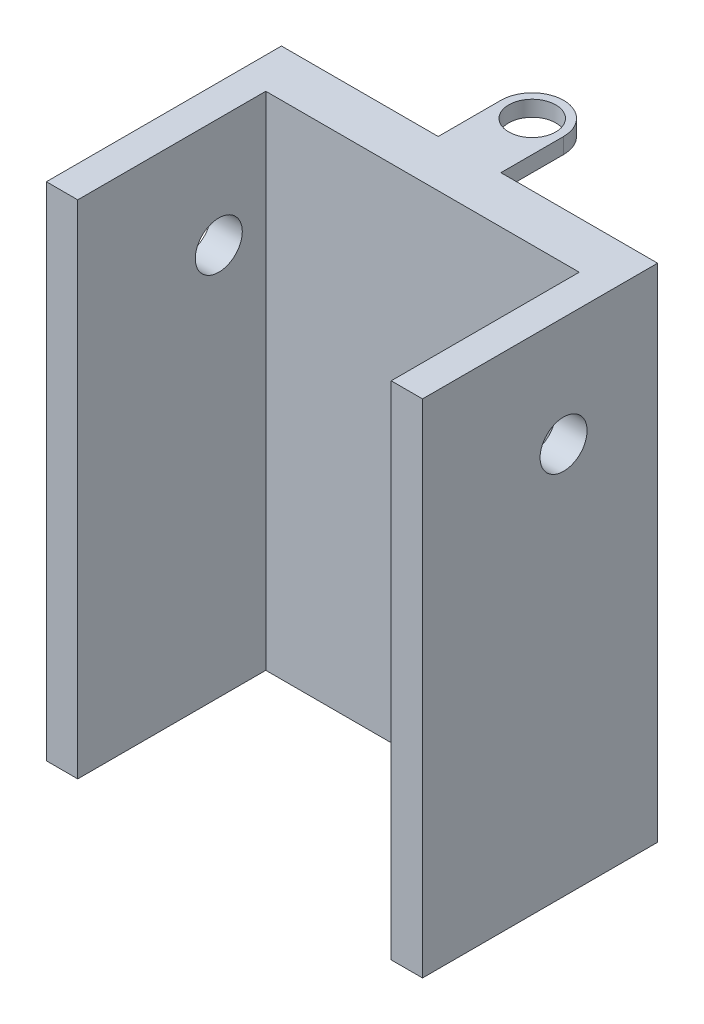
from build123d import *

# Parameters (mm, degrees)
ESQUISSE1_W                  = 20
ESQUISSE1_H                  = 32
BOSS_EXTRU_1_DEPTH           = 3
ESQUISSE2_W                  = 2
ESQUISSE2_H                  = 32
BOSS_EXTRU_2_DEPTH           = 15
ENL_V_MAT_EXTRU_1_DEPTH      = 26
ENL_V_MAT_EXTRU_1_DEPTH_BACK = 26
ESQUISSE3_R                  = 1.5
ESQUISSE4_W                  = 0.474893163
ESQUISSE4_H                  = 2.645833334
ENL_V_MAT_EXTRU_2_DEPTH      = 1
ESQUISSE5_R                  = 1.5
BOSS_EXTRU_3_DEPTH           = 1


with BuildPart() as part:
    # Esquisse1 → Boss.-Extru.1 (new body)
    with BuildSketch(Plane.XY):
        Rectangle(ESQUISSE1_W, ESQUISSE1_H)
    extrude(amount=BOSS_EXTRU_1_DEPTH)

    # Esquisse2 → Boss.-Extru.2 (add)
    with BuildSketch(Plane.XY):
        with Locations((11, 0)):
            Rectangle(ESQUISSE2_W, ESQUISSE2_H)
        with Locations((-11, 0)):
            Rectangle(ESQUISSE2_W, ESQUISSE2_H)
    extrude(amount=BOSS_EXTRU_2_DEPTH)

    # Esquisse3 → Enlèv. mat.-Extru.1 (cut, two sides: drawn at the far end of the back side and taken through both)
    with BuildSketch(Plane(origin=(0, 0, 0), x_dir=(0, 0, -1), z_dir=(1, 0, 0)).offset(-ENL_V_MAT_EXTRU_1_DEPTH_BACK)):
        with Locations((-6, 9)):
            Circle(ESQUISSE3_R)
    extrude(amount=ENL_V_MAT_EXTRU_1_DEPTH + ENL_V_MAT_EXTRU_1_DEPTH_BACK, mode=Mode.SUBTRACT)

    # Esquisse4 → Enlèv. mat.-Extru.2 (cut)
    # profile 1 of 20: a face of its own
    with BuildSketch(Plane(origin=(0, 0, 0), x_dir=(-1, 0, 0), z_dir=(0, 0, -1))):
        Polygon((-6.055138784, 11.645833333), (-4.766143058, 11.645833333), (-4.766143058, 11.170940171), (-5.580245622, 11.170940171), (-5.580245622, 10.662126068), (-4.766143058, 10.662126068), (-4.766143058, 10.187232906), (-5.580245622, 10.187232906), (-5.580245622, 9), (-6.055138784, 9), align=None)
    # profile 2 of 20: a face of its own
    with BuildSketch(Plane(origin=(0, 0, 0), x_dir=(-1, 0, 0), z_dir=(0, 0, -1))):
        Polygon((-4.291249895, 11.645833333), (-3.816356733, 11.645833333), (-3.816356733, 9.474893162), (-3.070096049, 9.474893162), (-3.070096049, 9), (-4.291249895, 9), align=None)
    # profile 3 of 20: a face of its own
    with BuildSketch(Plane(origin=(0, 0, 0), x_dir=(-1, 0, 0), z_dir=(0, 0, -1))):
        Polygon((-1.848412188, 11.645833333), (-1.407969981, 11.645833333), (-0.339460365, 9), (-0.846684424, 9), (-1.052330124, 9.542735043), (-2.205112075, 9.542735043), (-2.410757775, 9), (-2.917451818, 9), align=None)
        Polygon((-1.628456092, 10.936143663), (-2.02490708, 10.017628205), (-1.232005104, 10.017628205), align=None, mode=Mode.SUBTRACT)
    # profile 4 of 20: a face of its own
    with BuildSketch(Plane(origin=(0, 0, 0), x_dir=(-1, 0, 0), z_dir=(0, 0, -1))):
        Polygon((0.259986249, 11.645833333), (0.752899911, 11.645833333), (1.356586643, 9.800322182), (1.964513493, 11.645833333), (2.452657022, 11.645833333), (2.899989421, 9), (2.419266097, 9), (2.136768267, 10.671136318), (1.586613019, 9), (1.123380179, 9), (0.576405019, 10.671136318), (0.294437204, 9), (-0.186816135, 9), align=None)
    # profile 5 of 20: a face of its own
    with BuildSketch(Plane(origin=(0, 0, 0), x_dir=(-1, 0, 0), z_dir=(0, 0, -1))):
        Polygon((3.340961643, 11.645833333), (4.76564113, 11.645833333), (4.76564113, 11.170940171), (3.815854805, 11.170940171), (3.815854805, 10.662126068), (4.76564113, 10.662126068), (4.76564113, 10.187232906), (3.815854805, 10.187232906), (3.815854805, 9.474893162), (4.76564113, 9.474893162), (4.76564113, 9), (3.340961643, 9), align=None)
    # profile 6 of 20: a face of its own
    with BuildSketch(Plane(origin=(0, 0, 0), x_dir=(-1, 0, 0), z_dir=(0, 0, -1))):
        with BuildLine():
            Line((-9.820363143, 6.337873932), (-9.221976558, 6.337873932))
            add(Edge.make_bspline(
                [(-9.221976558, 6.337873932), (-9.175325441, 6.337547824), (-9.085148304, 6.336917455), (-8.954499474, 6.329814712), (-8.833012686, 6.318891197), (-8.72060963, 6.303863923), (-8.617520748, 6.283978724), (-8.523878973, 6.259036639), (-8.43937002, 6.230245152), (-8.363067266, 6.196366125), (-8.29341019, 6.156866544), (-8.227268573, 6.112867181), (-8.164772283, 6.062756213), (-8.105044284, 6.007500379), (-8.048855377, 5.94608879), (-7.995269815, 5.879538645), (-7.945599618, 5.806884876), (-7.898343362, 5.72986949), (-7.855606366, 5.648166103), (-7.818329562, 5.562470158), (-7.787102557, 5.47333314), (-7.761728998, 5.380660053), (-7.741503343, 5.284758542), (-7.72735186, 5.185435088), (-7.718603273, 5.082781647), (-7.717715802, 5.013208369), (-7.717264853, 4.977856237)],
                knots=[0, 0, 0, 0, 1.44355588, 2.790409838, 4.047694926, 5.217575253, 6.298404546, 7.294384826, 8.214239204, 9.058592145, 9.873746385, 10.689560431, 11.514393297, 12.350027578, 13.205127629, 14.088021785, 14.991911688, 15.926770944, 16.882954281, 17.842803888, 18.816321264, 19.80318086, 20.814351908, 21.847355356, 22.906180909, 24, 24, 24, 24], degree=3))
            add(Edge.make_bspline(
                [(-7.717264853, 4.977856237), (-7.71844568, 4.927972076), (-7.720770209, 4.829772187), (-7.740350739, 4.68566498), (-7.772019086, 4.54752385), (-7.816547658, 4.416429389), (-7.871751168, 4.293549013), (-7.937697942, 4.181049666), (-8.013421047, 4.079535187), (-8.098038304, 3.989511036), (-8.189658185, 3.912134058), (-8.284869717, 3.845866339), (-8.384600433, 3.793608713), (-8.472477132, 3.760469563), (-8.548677193, 3.739859879), (-8.615580022, 3.727679357), (-8.691574809, 3.716509084), (-8.777370141, 3.707876938), (-8.872589651, 3.700179184), (-8.977612885, 3.695996524), (-9.092099808, 3.692521355), (-9.171621802, 3.69220505), (-9.212966308, 3.692040598)],
                knots=[0, 0, 0, 0, 1.315458931, 2.589557908, 3.828601765, 5.048913369, 6.235739168, 7.376350998, 8.481830359, 9.569842114, 10.627874879, 11.640079404, 12.624025415, 13.590060155, 14.111227486, 14.704434459, 15.382649715, 16.137166398, 16.978595427, 17.902333227, 18.909396075, 20, 20, 20, 20], degree=3))
            Line((-9.212966308, 3.692040598), (-9.820363143, 3.692040598))
            Line((-9.820363143, 3.692040598), (-9.820363143, 6.337873932))
        make_face()
        with BuildLine():
            Line((-9.345469981, 5.862980769), (-9.345469981, 4.166933761))
            Line((-9.345469981, 4.166933761), (-9.097423106, 4.166933761))
            add(Edge.make_bspline(
                [(-9.097423106, 4.166933761), (-9.067909337, 4.166987842), (-9.011144535, 4.167091859), (-8.929189009, 4.17204626), (-8.853400929, 4.177019113), (-8.78398892, 4.186457754), (-8.720447824, 4.196971735), (-8.663650529, 4.21160338), (-8.612426195, 4.226972684), (-8.567400519, 4.246539713), (-8.526160669, 4.268563705), (-8.487977278, 4.294367366), (-8.451119615, 4.323021359), (-8.416276764, 4.355368437), (-8.383316853, 4.390980265), (-8.352434894, 4.430040335), (-8.323218694, 4.472429474), (-8.296418178, 4.518371803), (-8.271927723, 4.567382161), (-8.250201945, 4.618985811), (-8.23218807, 4.673612501), (-8.217216039, 4.730750859), (-8.206516826, 4.790898339), (-8.197665267, 4.853609437), (-8.193102031, 4.919132609), (-8.192475755, 4.963716766), (-8.192158015, 4.986336472)],
                knots=[0, 0, 0, 0, 1.50275155, 2.890291501, 4.180787663, 5.369391935, 6.45668281, 7.458360028, 8.354766181, 9.177074746, 9.954075863, 10.732690366, 11.5210699, 12.329727389, 13.151100085, 13.990027547, 14.863562427, 15.770965086, 16.696477834, 17.652329173, 18.619756807, 19.62365428, 20.657822005, 21.729286259, 22.847956731, 24, 24, 24, 24], degree=3))
            add(Edge.make_bspline(
                [(-8.192158015, 4.986336472), (-8.192790845, 5.020999033), (-8.194024816, 5.088588341), (-8.205924957, 5.187033644), (-8.225296117, 5.279734645), (-8.252936895, 5.366347305), (-8.287778954, 5.447115051), (-8.331391911, 5.521353609), (-8.381898835, 5.590310086), (-8.421838332, 5.630762168), (-8.441794934, 5.650974893)],
                knots=[0, 0, 0, 0, 1.13821349, 2.219428113, 3.251817212, 4.244760574, 5.201143372, 6.134805572, 7.068016741, 8, 8, 8, 8], degree=3))
            add(Edge.make_bspline(
                [(-8.441794934, 5.650974893), (-8.461474033, 5.668198868), (-8.501666365, 5.703376886), (-8.572230892, 5.745529147), (-8.649989345, 5.782564041), (-8.736720606, 5.811928581), (-8.831586456, 5.835151311), (-8.935151916, 5.85116746), (-9.046862373, 5.861459268), (-9.124252774, 5.862462737), (-9.164204957, 5.862980769)],
                knots=[0, 0, 0, 0, 0.813307809, 1.661089106, 2.549956539, 3.493439533, 4.508053171, 5.589449661, 6.755572447, 8, 8, 8, 8], degree=3))
            Line((-9.164204957, 5.862980769), (-9.345469981, 5.862980769))
        make_face(mode=Mode.SUBTRACT)
    # profile 7 of 20: a face of its own
    with BuildSketch(Plane(origin=(0, 0, 0), x_dir=(-1, 0, 0), z_dir=(0, 0, -1))):
        Polygon((-7.24237169, 6.337873932), (-5.817692203, 6.337873932), (-5.817692203, 5.862980769), (-6.767478528, 5.862980769), (-6.767478528, 5.354166667), (-5.817692203, 5.354166667), (-5.817692203, 4.879273504), (-6.767478528, 4.879273504), (-6.767478528, 4.166933761), (-5.817692203, 4.166933761), (-5.817692203, 3.692040598), (-7.24237169, 3.692040598), align=None)
    # profile 8 of 20: a face of its own
    with BuildSketch(Plane(origin=(0, 0, 0), x_dir=(-1, 0, 0), z_dir=(0, 0, -1))):
        Polygon((-5.614166562, 6.337873932), (-4.189487075, 6.337873932), (-4.189487075, 5.862980769), (-4.664380237, 5.862980769), (-4.664380237, 3.692040598), (-5.1392734, 3.692040598), (-5.1392734, 5.862980769), (-5.614166562, 5.862980769), align=None)
    # profile 9 of 20: a face of its own
    with BuildSketch(Plane(origin=(0, 0, 0), x_dir=(-1, 0, 0), z_dir=(0, 0, -1))):
        Polygon((-3.816356733, 6.337873932), (-2.391677246, 6.337873932), (-2.391677246, 5.862980769), (-3.341463571, 5.862980769), (-3.341463571, 5.354166667), (-2.391677246, 5.354166667), (-2.391677246, 4.879273504), (-3.341463571, 4.879273504), (-3.341463571, 4.166933761), (-2.391677246, 4.166933761), (-2.391677246, 3.692040598), (-3.816356733, 3.692040598), align=None)
    # profile 10 of 20: a face of its own
    with BuildSketch(Plane(origin=(0, 0, 0), x_dir=(-1, 0, 0), z_dir=(0, 0, -1))):
        with BuildLine():
            Line((0.457681729, 5.87888121), (0.109462077, 5.546031985))
            add(Edge.make_bspline(
                [(0.109462077, 5.546031985), (0.079923249, 5.576575182), (0.022224665, 5.636235615), (-0.070749469, 5.715220771), (-0.167439182, 5.781044212), (-0.265963571, 5.836480294), (-0.368094802, 5.878421641), (-0.472651961, 5.908985008), (-0.580302676, 5.927618337), (-0.653156539, 5.92975032), (-0.689800076, 5.93082265)],
                knots=[0, 0, 0, 0, 1.115251505, 2.178435587, 3.19620269, 4.182487026, 5.141301733, 6.088180966, 7.038406374, 8, 8, 8, 8], degree=3))
            add(Edge.make_bspline(
                [(-0.689800076, 5.93082265), (-0.720401882, 5.929975471), (-0.780791174, 5.928303659), (-0.869458481, 5.916047622), (-0.954273342, 5.895205698), (-1.035526092, 5.866481666), (-1.112977642, 5.829314293), (-1.186790378, 5.783732346), (-1.256782319, 5.730147494), (-1.322028911, 5.668836988), (-1.3817142, 5.601850653), (-1.434449953, 5.530376394), (-1.478624606, 5.454577953), (-1.514878024, 5.375222963), (-1.543118036, 5.291944128), (-1.563284953, 5.204797515), (-1.574948958, 5.113679339), (-1.576689889, 5.051737882), (-1.577574682, 5.020257412)],
                knots=[0, 0, 0, 0, 1.035432265, 2.043311493, 3.022114605, 3.98653278, 4.95457646, 5.923598177, 6.917315552, 7.932509744, 8.948865224, 9.949768934, 10.933144597, 11.912367597, 12.897413939, 13.903909035, 14.934704909, 16, 16, 16, 16], degree=3))
            add(Edge.make_bspline(
                [(-1.577574682, 5.020257412), (-1.577319695, 4.998162215), (-1.57681711, 4.954612128), (-1.571315431, 4.890189463), (-1.562456431, 4.827684247), (-1.549635263, 4.76719116), (-1.533602266, 4.708657777), (-1.51479191, 4.651579135), (-1.491194596, 4.59674393), (-1.46500122, 4.54351529), (-1.434538626, 4.493345622), (-1.401694331, 4.44550468), (-1.366080055, 4.400226975), (-1.327465122, 4.357697605), (-1.285306076, 4.318581207), (-1.240692572, 4.281701506), (-1.192872041, 4.247981724), (-1.142837838, 4.216575628), (-1.09015773, 4.189292884), (-1.036261051, 4.16457999), (-0.980330618, 4.144509445), (-0.923047417, 4.128330755), (-0.86461616, 4.114573196), (-0.804465333, 4.106102244), (-0.74311637, 4.099687291), (-0.701654768, 4.099291205), (-0.680789826, 4.09909188)],
                knots=[0, 0, 0, 0, 1.103660481, 2.175337485, 3.227646561, 4.255952547, 5.262355991, 6.258840057, 7.255597736, 8.242457506, 9.22035537, 10.185017736, 11.140346927, 12.096287581, 13.051739095, 14.01125915, 14.986044842, 15.97314143, 16.960198552, 17.947847494, 18.933482797, 19.925264591, 20.920966487, 21.929612487, 22.958107872, 24, 24, 24, 24], degree=3))
            add(Edge.make_bspline(
                [(-0.680789826, 4.09909188), (-0.645399298, 4.100115562), (-0.575866112, 4.102126831), (-0.473816165, 4.117854667), (-0.376572732, 4.143726068), (-0.298875695, 4.17427869), (-0.238002118, 4.2044498), (-0.191659964, 4.232356591), (-0.143738565, 4.263573401), (-0.095033854, 4.299278386), (-0.044998, 4.339043071), (0.005485749, 4.383738379), (0.057709785, 4.431892555), (0.091921234, 4.466261137), (0.109462077, 4.483882545)],
                knots=[0, 0, 0, 0, 1.404581149, 2.759636711, 4.088442092, 5.392261763, 6.066678138, 6.783632037, 7.538459478, 8.336747902, 9.180226004, 10.074962426, 11.012997595, 12, 12, 12, 12], degree=3))
            Line((0.109462077, 4.483882545), (0.447081435, 4.129302718))
            add(Edge.make_bspline(
                [(0.447081435, 4.129302718), (0.423348611, 4.106389422), (0.377027215, 4.061667568), (0.307152675, 3.998166709), (0.237366074, 3.941104127), (0.169353313, 3.888408703), (0.10200027, 3.84161558), (0.035314089, 3.800678027), (-0.029950315, 3.764560674), (-0.095148176, 3.733872621), (-0.16068519, 3.707815277), (-0.228115076, 3.685381614), (-0.297643973, 3.666403542), (-0.369696532, 3.651090731), (-0.443600691, 3.638811923), (-0.520048094, 3.630523799), (-0.598554027, 3.624951969), (-0.651805818, 3.624451294), (-0.678669767, 3.624198718)],
                knots=[0, 0, 0, 0, 1.244526981, 2.429050516, 3.560637417, 4.644440555, 5.67424972, 6.652764056, 7.595344123, 8.486817594, 9.369275933, 10.254498637, 11.166417451, 12.086725134, 13.032340136, 13.991389299, 14.986715468, 16, 16, 16, 16], degree=3))
            add(Edge.make_bspline(
                [(-0.678669767, 3.624198718), (-0.728015514, 3.625456639), (-0.824571425, 3.627918042), (-0.966071595, 3.64615537), (-1.100492957, 3.676729928), (-1.228162535, 3.719970787), (-1.349039732, 3.775208958), (-1.463093625, 3.842928362), (-1.570140383, 3.922949078), (-1.669315279, 4.014333187), (-1.759023693, 4.115259264), (-1.838315542, 4.223626183), (-1.903905763, 4.339966527), (-1.958366736, 4.462561577), (-2.000954501, 4.591970783), (-2.030929068, 4.728334127), (-2.049414164, 4.87151994), (-2.05143646, 4.96931915), (-2.052467844, 5.019197382)],
                knots=[0, 0, 0, 0, 1.078019885, 2.10938526, 3.111377082, 4.085535484, 5.04941344, 6.010039228, 6.978205633, 7.964457913, 8.951525778, 9.924444315, 10.892603023, 11.863865945, 12.85144698, 13.863884204, 14.910567087, 16, 16, 16, 16], degree=3))
            add(Edge.make_bspline(
                [(-2.052467844, 5.019197382), (-2.052032031, 5.05172754), (-2.051168357, 5.116194361), (-2.042091056, 5.211159212), (-2.029436772, 5.303732954), (-2.0093619, 5.392954367), (-1.985163622, 5.480025427), (-1.955069884, 5.563999772), (-1.919128751, 5.645118755), (-1.878498688, 5.723518173), (-1.832534305, 5.798684425), (-1.781187043, 5.869971715), (-1.72577878, 5.937930369), (-1.664978148, 6.001658787), (-1.599668658, 6.061716519), (-1.529555446, 6.1177781), (-1.455060207, 6.170647515), (-1.375981311, 6.218961392), (-1.29385505, 6.262663862), (-1.209717253, 6.301211307), (-1.123774635, 6.333428094), (-1.03639057, 6.36015073), (-0.947195863, 6.380097288), (-0.856827161, 6.39519619), (-0.764515535, 6.403636572), (-0.702536276, 6.405018317), (-0.671249561, 6.405715812)],
                knots=[0, 0, 0, 0, 1.071919942, 2.124283339, 3.142214191, 4.149696895, 5.136002878, 6.119640489, 7.086990633, 8.058538607, 9.028339693, 9.988281803, 10.952401235, 11.916291999, 12.888973767, 13.874849856, 14.873389453, 15.898127285, 16.927174885, 17.938320013, 18.946391617, 19.950418109, 20.947802303, 21.956882652, 22.968648068, 24, 24, 24, 24], degree=3))
            add(Edge.make_bspline(
                [(-0.671249561, 6.405715812), (-0.644558786, 6.40531599), (-0.591454745, 6.404520504), (-0.512373918, 6.397889259), (-0.433925541, 6.387474956), (-0.356390485, 6.37176199), (-0.27921414, 6.353108715), (-0.20341069, 6.328684823), (-0.127784293, 6.301459794), (-0.053521038, 6.26891783), (0.019482736, 6.233395337), (0.089516801, 6.193093778), (0.157757021, 6.150493267), (0.222691236, 6.103072519), (0.285535801, 6.052551572), (0.345962099, 5.998694718), (0.403439852, 5.940604004), (0.439509698, 5.899559486), (0.457681729, 5.87888121)],
                knots=[0, 0, 0, 0, 0.996412454, 1.982464992, 2.961075852, 3.949442424, 4.934965278, 5.923860011, 6.921385422, 7.934793307, 8.949617135, 9.951082467, 10.950285876, 11.951772932, 12.951063433, 13.960125323, 14.972308753, 16, 16, 16, 16], degree=3))
        make_face()
    # profile 11 of 20: a face of its own
    with BuildSketch(Plane(origin=(0, 0, 0), x_dir=(-1, 0, 0), z_dir=(0, 0, -1))):
        Polygon((0.66120737, 6.337873932), (2.085886857, 6.337873932), (2.085886857, 5.862980769), (1.610993694, 5.862980769), (1.610993694, 3.692040598), (1.136100532, 3.692040598), (1.136100532, 5.862980769), (0.66120737, 5.862980769), align=None)
    # profile 12 of 20: a face of its own
    with BuildSketch(Plane(origin=(0, 0, 0), x_dir=(-1, 0, 0), z_dir=(0, 0, -1))):
        with Locations((2.6286219, 5.014957265)):
            Rectangle(ESQUISSE4_W, ESQUISSE4_H)
    # profile 13 of 20: a face of its own
    with BuildSketch(Plane(origin=(0, 0, 0), x_dir=(-1, 0, 0), z_dir=(0, 0, -1))):
        with BuildLine():
            add(Edge.make_bspline(
                [(4.720059867, 6.405715812), (4.766060922, 6.404524762), (4.856877424, 6.40217336), (4.990435726, 6.382572591), (5.119143845, 6.350635946), (5.242943579, 6.306241701), (5.361524948, 6.248187432), (5.475306229, 6.178119018), (5.583879861, 6.094713957), (5.686133271, 5.999917953), (5.780633862, 5.896831438), (5.862518681, 5.785840478), (5.932347049, 5.669820958), (5.990220988, 5.548462003), (6.034302765, 5.420923143), (6.065236771, 5.287854658), (6.085110337, 5.149294404), (6.087396103, 5.054953758), (6.088557797, 5.007007045)],
                knots=[0, 0, 0, 0, 1.014329547, 2.002516266, 2.970391464, 3.935626869, 4.897733899, 5.877609409, 6.878433252, 7.912639331, 8.949961323, 9.958554974, 10.949718813, 11.932905612, 12.9188844, 13.919928257, 14.942845884, 16, 16, 16, 16], degree=3))
            add(Edge.make_bspline(
                [(6.088557797, 5.007007045), (6.087320643, 4.95960058), (6.084882792, 4.866184621), (6.066048097, 4.728901255), (6.034593158, 4.597258211), (5.991259043, 4.470957511), (5.934434719, 4.350610913), (5.865968079, 4.235450021), (5.78405242, 4.126543556), (5.691675527, 4.02394996), (5.589976584, 3.930824258), (5.48226126, 3.848757394), (5.369026916, 3.77921703), (5.250439292, 3.72223502), (5.126244082, 3.67801338), (4.996748064, 3.6468118), (4.86195925, 3.62784997), (4.77029632, 3.625428042), (4.72376997, 3.624198718)],
                knots=[0, 0, 0, 0, 1.051557043, 2.072126891, 3.067553643, 4.050577992, 5.02905126, 6.015227836, 7.017913613, 8.04756643, 9.074058332, 10.072836633, 11.047628519, 12.017157415, 12.98668631, 13.966869689, 14.968021931, 16, 16, 16, 16], degree=3))
            add(Edge.make_bspline(
                [(4.72376997, 3.624198718), (4.675108986, 3.625301482), (4.579496804, 3.627468263), (4.439567948, 3.648073363), (4.305504013, 3.67911184), (4.178431213, 3.725435103), (4.057055421, 3.783343076), (3.94226842, 3.854660218), (3.834108786, 3.939268669), (3.73319694, 4.035001578), (3.641770564, 4.139754377), (3.561068853, 4.25041642), (3.49299517, 4.366142346), (3.437547024, 4.486986318), (3.393833932, 4.612197319), (3.362999313, 4.74253792), (3.344784568, 4.877695518), (3.34224736, 4.96949726), (3.340961643, 5.016017294)],
                knots=[0, 0, 0, 0, 1.067978421, 2.098431617, 3.099715153, 4.085208694, 5.062210972, 6.048429807, 7.046490867, 8.072918869, 9.098532598, 10.095778865, 11.076610158, 12.041847152, 13.011192615, 13.984257998, 14.978533688, 16, 16, 16, 16], degree=3))
            add(Edge.make_bspline(
                [(3.340961643, 5.016017294), (3.341365175, 5.047313538), (3.342167129, 5.109509743), (3.351827512, 5.201681345), (3.365735686, 5.29205388), (3.386305215, 5.380267033), (3.411291935, 5.466943106), (3.443665762, 5.551275297), (3.480515937, 5.634164506), (3.523571897, 5.714631707), (3.571445961, 5.791936535), (3.623680828, 5.865714329), (3.680407841, 5.935073008), (3.741444264, 6.000468369), (3.807000435, 6.061470563), (3.876214033, 6.118943162), (3.950427397, 6.171359488), (4.028016229, 6.219999653), (4.108543103, 6.26398411), (4.1916802, 6.301422365), (4.275714731, 6.334116556), (4.361769286, 6.359920256), (4.448921635, 6.3809371), (4.538102827, 6.3948359), (4.628507158, 6.404496015), (4.689469873, 6.405308248), (4.720059867, 6.405715812)],
                knots=[0, 0, 0, 0, 1.034744296, 2.056386356, 3.06226378, 4.057406941, 5.050368692, 6.043467995, 7.042652155, 8.049140477, 9.059438543, 10.048523776, 11.036952808, 12.020949711, 13.004946614, 13.997082645, 14.994316842, 16.007702937, 17.024872941, 18.026463647, 19.021641123, 20.005082605, 20.995858141, 21.984425357, 22.988620895, 24, 24, 24, 24], degree=3))
        make_face()
        with BuildLine():
            add(Edge.make_bspline(
                [(4.712639661, 5.93082265), (4.681680957, 5.929991958), (4.620580864, 5.928352505), (4.530958155, 5.915862093), (4.444917189, 5.895913486), (4.362934925, 5.867018171), (4.284656046, 5.830241769), (4.209941786, 5.785712781), (4.139826785, 5.731900573), (4.073376125, 5.671694083), (4.013348889, 5.604610216), (3.960312933, 5.532718443), (3.915930379, 5.456138824), (3.878759713, 5.375582764), (3.850778439, 5.290144432), (3.830848217, 5.200493075), (3.81825306, 5.10647422), (3.816665425, 5.042381688), (3.815854805, 5.009657118)],
                knots=[0, 0, 0, 0, 1.033739768, 2.040188636, 3.016340934, 3.979330865, 4.937572243, 5.900995986, 6.878200029, 7.884839167, 8.891893314, 9.879764717, 10.863503415, 11.843163062, 12.837761627, 13.859916423, 14.907309254, 16, 16, 16, 16], degree=3))
            add(Edge.make_bspline(
                [(3.815854805, 5.009657118), (3.816929564, 4.973390933), (3.819035912, 4.902315219), (3.833856432, 4.798631882), (3.859212866, 4.700713261), (3.895827064, 4.609038261), (3.941238276, 4.5225889), (3.997631794, 4.442424737), (4.06409431, 4.368065788), (4.115296494, 4.324651936), (4.141283825, 4.302617521)],
                knots=[0, 0, 0, 0, 1.078454662, 2.113592447, 3.107694534, 4.079536787, 5.043276885, 6.005368276, 6.987637804, 8, 8, 8, 8], degree=3))
            add(Edge.make_bspline(
                [(4.141283825, 4.302617521), (4.162572411, 4.286339342), (4.204669946, 4.254149734), (4.271866779, 4.212892147), (4.341066284, 4.17753028), (4.41279066, 4.148958309), (4.486888428, 4.126484078), (4.563349427, 4.110745743), (4.642065319, 4.100868576), (4.695296693, 4.099688068), (4.722179926, 4.09909188)],
                knots=[0, 0, 0, 0, 1.023928204, 2.024787132, 3.009472467, 3.9914905, 4.972207045, 5.96565515, 6.972602802, 8, 8, 8, 8], degree=3))
            add(Edge.make_bspline(
                [(4.722179926, 4.09909188), (4.752606294, 4.099929615), (4.812471131, 4.101577885), (4.900425465, 4.113914533), (4.984688389, 4.134792596), (5.065783013, 4.163434431), (5.143475497, 4.200672592), (5.217386137, 4.24658273), (5.287644519, 4.300601126), (5.354010521, 4.361598259), (5.414672183, 4.42894639), (5.467597465, 4.501221626), (5.513391162, 4.576831526), (5.549788864, 4.656846235), (5.578875614, 4.74051045), (5.598565966, 4.828194703), (5.611267523, 4.919537526), (5.612855605, 4.981699545), (5.613664635, 5.013367221)],
                knots=[0, 0, 0, 0, 1.026359118, 2.019393844, 2.989460624, 3.950973911, 4.916101784, 5.890408035, 6.881132271, 7.902007068, 8.92769091, 9.933912415, 10.920395702, 11.90457117, 12.894218921, 13.903490204, 14.931958862, 16, 16, 16, 16], degree=3))
            add(Edge.make_bspline(
                [(5.613664635, 5.013367221), (5.612827613, 5.044852799), (5.611180064, 5.106827358), (5.598821702, 5.19793534), (5.578076042, 5.285232492), (5.549348199, 5.368861382), (5.512664265, 5.448903996), (5.467300859, 5.525078858), (5.413417155, 5.597312324), (5.352253284, 5.665112152), (5.285680169, 5.727415851), (5.214207279, 5.781484136), (5.139834505, 5.828467757), (5.060855372, 5.865272828), (4.978885728, 5.89459535), (4.893425389, 5.916188876), (4.804150669, 5.92826476), (4.743415231, 5.929962419), (4.712639661, 5.93082265)],
                knots=[0, 0, 0, 0, 1.055025985, 2.07665775, 3.074803781, 4.057872707, 5.035505728, 6.020516407, 7.023567878, 8.050795229, 9.077271434, 10.074415901, 11.050397877, 12.019801805, 12.988065821, 13.964604439, 14.968634123, 16, 16, 16, 16], degree=3))
        make_face(mode=Mode.SUBTRACT)
    # profile 14 of 20: a face of its own
    with BuildSketch(Plane(origin=(0, 0, 0), x_dir=(-1, 0, 0), z_dir=(0, 0, -1))):
        Polygon((6.563450959, 6.337873932), (6.991172814, 6.337873932), (8.191656088, 4.596775674), (8.191656088, 6.337873932), (8.66654925, 6.337873932), (8.66654925, 3.692040598), (8.235647307, 3.692040598), (7.038344122, 5.427838709), (7.038344122, 3.692040598), (6.563450959, 3.692040598), align=None)
    # profile 15 of 20: a face of its own
    with BuildSketch(Plane(origin=(0, 0, 0), x_dir=(-1, 0, 0), z_dir=(0, 0, -1))):
        with BuildLine():
            Line((-5.732889853, 0.676394732), (-6.087999695, 0.351495726))
            add(Edge.make_bspline(
                [(-6.087999695, 0.351495726), (-6.103211078, 0.372952964), (-6.132414812, 0.414147866), (-6.179751019, 0.469308812), (-6.226873478, 0.516365204), (-6.274218752, 0.555120462), (-6.322206489, 0.585339119), (-6.370753391, 0.606734262), (-6.419584231, 0.620335358), (-6.452391018, 0.622029021), (-6.468550243, 0.622863248)],
                knots=[0, 0, 0, 0, 1.299362458, 2.494594718, 3.587462134, 4.587049575, 5.512617175, 6.380583204, 7.202344345, 8, 8, 8, 8], degree=3))
            add(Edge.make_bspline(
                [(-6.468550243, 0.622863248), (-6.483623103, 0.622334644), (-6.512724838, 0.621314048), (-6.554211519, 0.611169402), (-6.591043985, 0.593661233), (-6.62318629, 0.57076783), (-6.648647738, 0.543186586), (-6.668976729, 0.514260953), (-6.680423659, 0.482333595), (-6.681930301, 0.460404598), (-6.682676177, 0.449548444)],
                knots=[0, 0, 0, 0, 1.185010067, 2.2879431, 3.333075148, 4.379039566, 5.372662701, 6.27520591, 7.14612461, 8, 8, 8, 8], degree=3))
            add(Edge.make_bspline(
                [(-6.682676177, 0.449548444), (-6.682208774, 0.438535739), (-6.681267489, 0.416357682), (-6.672175957, 0.383852977), (-6.658472422, 0.352092097), (-6.645378135, 0.332757738), (-6.638684958, 0.322874933)],
                knots=[0, 0, 0, 0, 0.967525499, 1.948461899, 2.951351359, 4, 4, 4, 4], degree=3))
            add(Edge.make_bspline(
                [(-6.638684958, 0.322874933), (-6.632600137, 0.315193133), (-6.618593681, 0.297510643), (-6.59188624, 0.269504335), (-6.558347302, 0.235194157), (-6.516686219, 0.195759934), (-6.468632458, 0.149783459), (-6.411958663, 0.099072083), (-6.348296155, 0.042055334), (-6.303046319, 0.002350935), (-6.279334998, -0.018454527)],
                knots=[0, 0, 0, 0, 0.473873513, 1.090794244, 1.870441696, 2.795289791, 3.865433203, 5.087734844, 6.473946851, 8, 8, 8, 8], degree=3))
            add(Edge.make_bspline(
                [(-6.279334998, -0.018454527), (-6.257078512, -0.037716393), (-6.214840326, -0.074271413), (-6.154743775, -0.126155393), (-6.101928916, -0.172834146), (-6.055626356, -0.213607122), (-6.016537998, -0.248902123), (-5.984499513, -0.278887859), (-5.959119607, -0.302980564), (-5.944692616, -0.317532572), (-5.938535552, -0.323742989)],
                knots=[0, 0, 0, 0, 1.543621617, 2.929473131, 4.163658386, 5.240097082, 6.164993805, 6.925417477, 7.541396219, 8, 8, 8, 8], degree=3))
            add(Edge.make_bspline(
                [(-5.938535552, -0.323742989), (-5.915176938, -0.349022012), (-5.870273478, -0.397617173), (-5.811914809, -0.472924389), (-5.763883737, -0.546439588), (-5.726725989, -0.619546077), (-5.698662963, -0.693298636), (-5.678878158, -0.769506045), (-5.667028907, -0.848964621), (-5.665713363, -0.9031854), (-5.665047972, -0.930609809)],
                knots=[0, 0, 0, 0, 1.206664779, 2.319633467, 3.337109185, 4.282041471, 5.190008762, 6.099243693, 7.03861361, 8, 8, 8, 8], degree=3))
            add(Edge.make_bspline(
                [(-5.665047972, -0.930609809), (-5.66552158, -0.957331532), (-5.666450817, -1.009760548), (-5.677832185, -1.086482603), (-5.694061347, -1.159908939), (-5.71915448, -1.229240575), (-5.749737841, -1.295615567), (-5.788078501, -1.358000005), (-5.833104349, -1.417025244), (-5.884710884, -1.471636136), (-5.94179384, -1.521191735), (-6.003020736, -1.5653073), (-6.068990278, -1.601730318), (-6.139138834, -1.631722076), (-6.213428854, -1.654822128), (-6.291771836, -1.67189522), (-6.374287613, -1.682142221), (-6.43071309, -1.683213423), (-6.459539993, -1.683760684)],
                knots=[0, 0, 0, 0, 1.043214005, 2.046824704, 3.02475056, 3.976699089, 4.921714032, 5.875962561, 6.831408892, 7.817874052, 8.806269674, 9.781291748, 10.760897367, 11.74438705, 12.757449933, 13.795994037, 14.874007457, 16, 16, 16, 16], degree=3))
            add(Edge.make_bspline(
                [(-6.459539993, -1.683760684), (-6.482168866, -1.683359232), (-6.526987013, -1.682564129), (-6.593042186, -1.676072768), (-6.656825923, -1.665596403), (-6.718266377, -1.650580642), (-6.777640348, -1.631553636), (-6.834950274, -1.608312877), (-6.889800526, -1.580498142), (-6.942606127, -1.548681413), (-6.993110377, -1.511737999), (-7.041951882, -1.470423197), (-7.088645502, -1.424101566), (-7.133415497, -1.372882656), (-7.175975415, -1.316621426), (-7.217718397, -1.256101419), (-7.256789257, -1.190199465), (-7.280925065, -1.143968711), (-7.2932531, -1.120355068)],
                knots=[0, 0, 0, 0, 1.016823716, 2.013894106, 2.979844003, 3.91962641, 4.853723003, 5.779685073, 6.695824784, 7.614987388, 8.547259901, 9.504950863, 10.487499108, 11.500346958, 12.559593716, 13.656357062, 14.802919212, 16, 16, 16, 16], degree=3))
            Line((-7.2932531, -1.120355068), (-6.875601525, -0.86965812))
            add(Edge.make_bspline(
                [(-6.875601525, -0.86965812), (-6.860180995, -0.89646269), (-6.830618522, -0.947849341), (-6.780522148, -1.01689382), (-6.72920097, -1.076018988), (-6.675468489, -1.124179802), (-6.619978072, -1.162020236), (-6.562461686, -1.189063635), (-6.502878923, -1.205803468), (-6.462293851, -1.207847789), (-6.442049508, -1.208867521)],
                knots=[0, 0, 0, 0, 1.283663364, 2.460892379, 3.537111102, 4.529833553, 5.449777664, 6.316464042, 7.160231139, 8, 8, 8, 8], degree=3))
            add(Edge.make_bspline(
                [(-6.442049508, -1.208867521), (-6.421458113, -1.208034752), (-6.381507807, -1.206419059), (-6.324483858, -1.19149539), (-6.272202143, -1.168064134), (-6.227010214, -1.134630963), (-6.188744538, -1.096044002), (-6.160502272, -1.053114243), (-6.142760291, -1.006665281), (-6.140884533, -0.974398776), (-6.139941135, -0.958170573)],
                knots=[0, 0, 0, 0, 1.13588714, 2.203786484, 3.234766741, 4.283437687, 5.291419208, 6.222934724, 7.106237994, 8, 8, 8, 8], degree=3))
            add(Edge.make_bspline(
                [(-6.139941135, -0.958170573), (-6.140812325, -0.943072871), (-6.142582064, -0.912403335), (-6.155617416, -0.866802666), (-6.175995648, -0.821222735), (-6.200104533, -0.783836843), (-6.224638343, -0.752534649), (-6.248098199, -0.725412714), (-6.276666097, -0.695447724), (-6.310269602, -0.662601985), (-6.348464724, -0.626586348), (-6.391283638, -0.58740434), (-6.439216666, -0.545401107), (-6.473095824, -0.51678892), (-6.49081086, -0.501827925)],
                knots=[0, 0, 0, 0, 0.916159276, 1.861089862, 2.860218735, 3.940849679, 4.552606315, 5.27541173, 6.11797699, 7.06649574, 8.129236253, 9.306560635, 10.591630461, 12, 12, 12, 12], degree=3))
            add(Edge.make_bspline(
                [(-6.49081086, -0.501827925), (-6.524487848, -0.473333964), (-6.589124181, -0.418645428), (-6.68046352, -0.337872182), (-6.762768443, -0.262382182), (-6.835328076, -0.191242208), (-6.899066941, -0.125766049), (-6.953553371, -0.065421883), (-6.998188808, -0.009744237), (-7.045157981, 0.056202208), (-7.089788085, 0.136562483), (-7.128361161, 0.23324521), (-7.153385744, 0.329915669), (-7.156189401, 0.394814891), (-7.15756934, 0.426757812)],
                knots=[0, 0, 0, 0, 1.345494975, 2.582412109, 3.71882943, 4.751509156, 5.681369928, 6.505683931, 7.230279997, 7.856715994, 8.973648664, 10.023341002, 11.027102913, 12, 12, 12, 12], degree=3))
            add(Edge.make_bspline(
                [(-7.15756934, 0.426757812), (-7.156995425, 0.449410018), (-7.155864751, 0.494037296), (-7.145778965, 0.559655207), (-7.130705373, 0.622970977), (-7.108814191, 0.683753602), (-7.080402079, 0.741926949), (-7.045896673, 0.797775802), (-7.004762169, 0.850786139), (-6.95840636, 0.90092282), (-6.907334127, 0.94674204), (-6.852756956, 0.987182093), (-6.794983758, 1.02133835), (-6.73436796, 1.049673445), (-6.670533952, 1.071362161), (-6.603951996, 1.086736203), (-6.534526592, 1.095880194), (-6.487304931, 1.097123213), (-6.463250096, 1.09775641)],
                knots=[0, 0, 0, 0, 1.010766082, 1.991317756, 2.957454644, 3.913069143, 4.869106762, 5.843196583, 6.838735724, 7.860187025, 8.887984031, 9.89767229, 10.887916223, 11.879572884, 12.879850636, 13.892031539, 14.926195476, 16, 16, 16, 16], degree=3))
            add(Edge.make_bspline(
                [(-6.463250096, 1.09775641), (-6.43207622, 1.096616003), (-6.369974545, 1.094344192), (-6.278155426, 1.076579368), (-6.188470351, 1.04864231), (-6.116200436, 1.014939324), (-6.058696613, 0.982291225), (-6.014625305, 0.952232968), (-5.969780377, 0.91779962), (-5.923800182, 0.878882671), (-5.877539104, 0.834748875), (-5.829681719, 0.786448872), (-5.780880141, 0.733565236), (-5.749166854, 0.695785413), (-5.732889853, 0.676394732)],
                knots=[0, 0, 0, 0, 1.282922637, 2.555718331, 3.837320111, 5.142675274, 5.830281639, 6.55870424, 7.337177975, 8.157850921, 9.037902056, 9.96903443, 10.957596896, 12, 12, 12, 12], degree=3))
        make_face()
    # profile 16 of 20: a face of its own
    with BuildSketch(Plane(origin=(0, 0, 0), x_dir=(-1, 0, 0), z_dir=(0, 0, -1))):
        Polygon((-5.19015481, 1.02991453), (-3.765475323, 1.02991453), (-3.765475323, 0.555021368), (-4.715261647, 0.555021368), (-4.715261647, 0.046207265), (-3.765475323, 0.046207265), (-3.765475323, -0.428685897), (-4.715261647, -0.428685897), (-4.715261647, -1.141025641), (-3.765475323, -1.141025641), (-3.765475323, -1.615918803), (-5.19015481, -1.615918803), align=None)
    # profile 17 of 20: a face of its own
    with BuildSketch(Plane(origin=(0, 0, 0), x_dir=(-1, 0, 0), z_dir=(0, 0, -1))):
        Polygon((-3.29058216, 1.02991453), (-2.862860305, 1.02991453), (-1.662377032, -0.711183727), (-1.662377032, 1.02991453), (-1.18748387, 1.02991453), (-1.18748387, -1.615918803), (-1.618385813, -1.615918803), (-2.815688998, 0.119879307), (-2.815688998, -1.615918803), (-3.29058216, -1.615918803), align=None)
    # profile 18 of 20: a face of its own
    with BuildSketch(Plane(origin=(0, 0, 0), x_dir=(-1, 0, 0), z_dir=(0, 0, -1))):
        with BuildLine():
            Line((0.77993066, 0.676394732), (0.424820818, 0.351495726))
            add(Edge.make_bspline(
                [(0.424820818, 0.351495726), (0.409609435, 0.372952964), (0.380405701, 0.414147866), (0.333069494, 0.469308812), (0.285947034, 0.516365204), (0.238601761, 0.555120462), (0.190614024, 0.585339119), (0.142067122, 0.606734262), (0.093236282, 0.620335358), (0.060429495, 0.622029021), (0.04427027, 0.622863248)],
                knots=[0, 0, 0, 0, 1.299362458, 2.494594718, 3.587462134, 4.587049575, 5.512617175, 6.380583204, 7.202344345, 8, 8, 8, 8], degree=3))
            add(Edge.make_bspline(
                [(0.04427027, 0.622863248), (0.029197409, 0.622334644), (9.5675e-05, 0.621314048), (-0.041391006, 0.611169402), (-0.078223472, 0.593661233), (-0.110365777, 0.57076783), (-0.135827225, 0.543186586), (-0.156156216, 0.514260953), (-0.167603147, 0.482333595), (-0.169109788, 0.460404598), (-0.169855665, 0.449548444)],
                knots=[0, 0, 0, 0, 1.185010067, 2.2879431, 3.333075148, 4.379039566, 5.372662701, 6.27520591, 7.14612461, 8, 8, 8, 8], degree=3))
            add(Edge.make_bspline(
                [(-0.169855665, 0.449548444), (-0.169388261, 0.438535739), (-0.168446976, 0.416357682), (-0.159355444, 0.383852977), (-0.145651909, 0.352092097), (-0.132557622, 0.332757738), (-0.125864445, 0.322874933)],
                knots=[0, 0, 0, 0, 0.967525499, 1.948461899, 2.951351359, 4, 4, 4, 4], degree=3))
            add(Edge.make_bspline(
                [(-0.125864445, 0.322874933), (-0.119779624, 0.315193133), (-0.105773169, 0.297510643), (-0.079065727, 0.269504335), (-0.045526789, 0.235194157), (-0.003865706, 0.195759934), (0.044188055, 0.149783459), (0.100861849, 0.099072083), (0.164524358, 0.042055334), (0.209774193, 0.002350935), (0.233485515, -0.018454527)],
                knots=[0, 0, 0, 0, 0.473873513, 1.090794244, 1.870441696, 2.795289791, 3.865433203, 5.087734844, 6.473946851, 8, 8, 8, 8], degree=3))
            add(Edge.make_bspline(
                [(0.233485515, -0.018454527), (0.255742, -0.037716393), (0.297980186, -0.074271413), (0.358076737, -0.126155393), (0.410891597, -0.172834146), (0.457194156, -0.213607122), (0.496282515, -0.248902123), (0.528321, -0.278887859), (0.553700906, -0.302980564), (0.568127897, -0.317532572), (0.57428496, -0.323742989)],
                knots=[0, 0, 0, 0, 1.543621617, 2.929473131, 4.163658386, 5.240097082, 6.164993805, 6.925417477, 7.541396219, 8, 8, 8, 8], degree=3))
            add(Edge.make_bspline(
                [(0.57428496, -0.323742989), (0.597643575, -0.349022012), (0.642547035, -0.397617173), (0.700905704, -0.472924389), (0.748936776, -0.546439588), (0.786094524, -0.619546077), (0.81415755, -0.693298636), (0.833942355, -0.769506045), (0.845791606, -0.848964621), (0.84710715, -0.9031854), (0.847772541, -0.930609809)],
                knots=[0, 0, 0, 0, 1.206664779, 2.319633467, 3.337109185, 4.282041471, 5.190008762, 6.099243693, 7.03861361, 8, 8, 8, 8], degree=3))
            add(Edge.make_bspline(
                [(0.847772541, -0.930609809), (0.847298932, -0.957331532), (0.846369696, -1.009760548), (0.834988328, -1.086482603), (0.818759165, -1.159908939), (0.793666033, -1.229240575), (0.763082672, -1.295615567), (0.724742012, -1.358000005), (0.679716164, -1.417025244), (0.628109629, -1.471636136), (0.571026672, -1.521191735), (0.509799777, -1.5653073), (0.443830235, -1.601730318), (0.373681679, -1.631722076), (0.299391659, -1.654822128), (0.221048676, -1.67189522), (0.1385329, -1.682142221), (0.082107423, -1.683213423), (0.05328052, -1.683760684)],
                knots=[0, 0, 0, 0, 1.043214005, 2.046824704, 3.02475056, 3.976699089, 4.921714032, 5.875962561, 6.831408892, 7.817874052, 8.806269674, 9.781291748, 10.760897367, 11.74438705, 12.757449933, 13.795994037, 14.874007457, 16, 16, 16, 16], degree=3))
            add(Edge.make_bspline(
                [(0.05328052, -1.683760684), (0.030651647, -1.683359232), (-0.014166501, -1.682564129), (-0.080221674, -1.676072768), (-0.14400541, -1.665596403), (-0.205445864, -1.650580642), (-0.264819835, -1.631553636), (-0.322129761, -1.608312877), (-0.376980013, -1.580498142), (-0.429785615, -1.548681413), (-0.480289865, -1.511737999), (-0.52913137, -1.470423197), (-0.575824989, -1.424101566), (-0.620594984, -1.372882656), (-0.663154902, -1.316621426), (-0.704897884, -1.256101419), (-0.743968744, -1.190199465), (-0.768104553, -1.143968711), (-0.780432588, -1.120355068)],
                knots=[0, 0, 0, 0, 1.016823716, 2.013894106, 2.979844003, 3.91962641, 4.853723003, 5.779685073, 6.695824784, 7.614987388, 8.547259901, 9.504950863, 10.487499108, 11.500346958, 12.559593716, 13.656357062, 14.802919212, 16, 16, 16, 16], degree=3))
            Line((-0.780432588, -1.120355068), (-0.362781012, -0.86965812))
            add(Edge.make_bspline(
                [(-0.362781012, -0.86965812), (-0.347360482, -0.89646269), (-0.317798009, -0.947849341), (-0.267701635, -1.01689382), (-0.216380458, -1.076018988), (-0.162647977, -1.124179802), (-0.107157559, -1.162020236), (-0.049641174, -1.189063635), (0.00994159, -1.205803468), (0.050526662, -1.207847789), (0.070771005, -1.208867521)],
                knots=[0, 0, 0, 0, 1.283663364, 2.460892379, 3.537111102, 4.529833553, 5.449777664, 6.316464042, 7.160231139, 8, 8, 8, 8], degree=3))
            add(Edge.make_bspline(
                [(0.070771005, -1.208867521), (0.0913624, -1.208034752), (0.131312706, -1.206419059), (0.188336655, -1.19149539), (0.24061837, -1.168064134), (0.285810299, -1.134630963), (0.324075975, -1.096044002), (0.35231824, -1.053114243), (0.370060222, -1.006665281), (0.37193598, -0.974398776), (0.372879378, -0.958170573)],
                knots=[0, 0, 0, 0, 1.13588714, 2.203786484, 3.234766741, 4.283437687, 5.291419208, 6.222934724, 7.106237994, 8, 8, 8, 8], degree=3))
            add(Edge.make_bspline(
                [(0.372879378, -0.958170573), (0.372008188, -0.943072871), (0.370238449, -0.912403335), (0.357203097, -0.866802666), (0.336824865, -0.821222735), (0.31271598, -0.783836843), (0.28818217, -0.752534649), (0.264722314, -0.725412714), (0.236154416, -0.695447724), (0.202550911, -0.662601985), (0.164355788, -0.626586348), (0.121536874, -0.58740434), (0.073603847, -0.545401107), (0.039724689, -0.51678892), (0.022009653, -0.501827925)],
                knots=[0, 0, 0, 0, 0.916159276, 1.861089862, 2.860218735, 3.940849679, 4.552606315, 5.27541173, 6.11797699, 7.06649574, 8.129236253, 9.306560635, 10.591630461, 12, 12, 12, 12], degree=3))
            add(Edge.make_bspline(
                [(0.022009653, -0.501827925), (-0.011667335, -0.473333964), (-0.076303668, -0.418645428), (-0.167643007, -0.337872182), (-0.24994793, -0.262382182), (-0.322507563, -0.191242208), (-0.386246429, -0.125766049), (-0.440732859, -0.065421883), (-0.485368295, -0.009744237), (-0.532337468, 0.056202208), (-0.576967573, 0.136562483), (-0.615540648, 0.23324521), (-0.640565231, 0.329915669), (-0.643368888, 0.394814891), (-0.644748827, 0.426757812)],
                knots=[0, 0, 0, 0, 1.345494975, 2.582412109, 3.71882943, 4.751509156, 5.681369928, 6.505683931, 7.230279997, 7.856715994, 8.973648664, 10.023341002, 11.027102913, 12, 12, 12, 12], degree=3))
            add(Edge.make_bspline(
                [(-0.644748827, 0.426757812), (-0.644174912, 0.449410018), (-0.643044238, 0.494037296), (-0.632958452, 0.559655207), (-0.61788486, 0.622970977), (-0.595993678, 0.683753602), (-0.567581566, 0.741926949), (-0.53307616, 0.797775802), (-0.491941656, 0.850786139), (-0.445585847, 0.90092282), (-0.394513614, 0.94674204), (-0.339936443, 0.987182093), (-0.282163245, 1.02133835), (-0.221547447, 1.049673445), (-0.157713439, 1.071362161), (-0.091131483, 1.086736203), (-0.021706079, 1.095880194), (0.025515582, 1.097123213), (0.049570417, 1.09775641)],
                knots=[0, 0, 0, 0, 1.010766082, 1.991317756, 2.957454644, 3.913069143, 4.869106762, 5.843196583, 6.838735724, 7.860187025, 8.887984031, 9.89767229, 10.887916223, 11.879572884, 12.879850636, 13.892031539, 14.926195476, 16, 16, 16, 16], degree=3))
            add(Edge.make_bspline(
                [(0.049570417, 1.09775641), (0.080744293, 1.096616003), (0.142845968, 1.094344192), (0.234665086, 1.076579368), (0.324350162, 1.04864231), (0.396620077, 1.014939324), (0.454123899, 0.982291225), (0.498195208, 0.952232968), (0.543040136, 0.91779962), (0.589020331, 0.878882671), (0.635281409, 0.834748875), (0.683138794, 0.786448872), (0.731940371, 0.733565236), (0.763653659, 0.695785413), (0.77993066, 0.676394732)],
                knots=[0, 0, 0, 0, 1.282922637, 2.555718331, 3.837320111, 5.142675274, 5.830281639, 6.55870424, 7.337177975, 8.157850921, 9.037902056, 9.96903443, 10.957596896, 12, 12, 12, 12], degree=3))
        make_face()
    # profile 19 of 20: a face of its own
    with BuildSketch(Plane(origin=(0, 0, 0), x_dir=(-1, 0, 0), z_dir=(0, 0, -1))):
        with BuildLine():
            add(Edge.make_bspline(
                [(2.566080166, 1.09775641), (2.612081221, 1.096565361), (2.702897723, 1.094213959), (2.836456025, 1.074613189), (2.965164144, 1.042676545), (3.088963878, 0.998282299), (3.207545247, 0.940228031), (3.321326528, 0.870159616), (3.42990016, 0.786754555), (3.53215357, 0.691958551), (3.626654162, 0.588872037), (3.70853898, 0.477881076), (3.778367348, 0.361861557), (3.836241287, 0.240502601), (3.880323064, 0.112963741), (3.91125707, -0.020104744), (3.931130636, -0.158664997), (3.933416402, -0.253005644), (3.934578096, -0.300952357)],
                knots=[0, 0, 0, 0, 1.014329547, 2.002516266, 2.970391464, 3.935626869, 4.897733899, 5.877609409, 6.878433252, 7.912639331, 8.949961323, 9.958554974, 10.949718813, 11.932905612, 12.9188844, 13.919928257, 14.942845884, 16, 16, 16, 16], degree=3))
            add(Edge.make_bspline(
                [(3.934578096, -0.300952357), (3.933340942, -0.348358821), (3.930903091, -0.44177478), (3.912068396, -0.579058147), (3.880613457, -0.710701191), (3.837279342, -0.837001891), (3.780455018, -0.957348488), (3.711988378, -1.07250938), (3.630072719, -1.181415846), (3.537695826, -1.284009441), (3.435996884, -1.377135143), (3.328281559, -1.459202008), (3.215047215, -1.528742371), (3.096459591, -1.585724382), (2.972264381, -1.629946022), (2.842768363, -1.661147602), (2.707979549, -1.680109432), (2.616316619, -1.68253136), (2.569790269, -1.683760684)],
                knots=[0, 0, 0, 0, 1.051557043, 2.072126891, 3.067553643, 4.050577992, 5.02905126, 6.015227836, 7.017913613, 8.04756643, 9.074058332, 10.072836633, 11.047628519, 12.017157415, 12.98668631, 13.966869689, 14.968021931, 16, 16, 16, 16], degree=3))
            add(Edge.make_bspline(
                [(2.569790269, -1.683760684), (2.521129285, -1.682657919), (2.425517103, -1.680491138), (2.285588247, -1.659886039), (2.151524312, -1.628847561), (2.024451512, -1.582524299), (1.90307572, -1.524616325), (1.788288719, -1.453299184), (1.680129085, -1.368690732), (1.579217239, -1.272957824), (1.487790863, -1.168205025), (1.407089152, -1.057542982), (1.339015469, -0.941817055), (1.283567323, -0.820973084), (1.239854231, -0.695762083), (1.209019612, -0.565421482), (1.190804867, -0.430263884), (1.188267659, -0.338462142), (1.186981942, -0.291942107)],
                knots=[0, 0, 0, 0, 1.067978421, 2.098431617, 3.099715153, 4.085208694, 5.062210972, 6.048429807, 7.046490867, 8.072918869, 9.098532598, 10.095778865, 11.076610158, 12.041847152, 13.011192615, 13.984257998, 14.978533688, 16, 16, 16, 16], degree=3))
            add(Edge.make_bspline(
                [(1.186981942, -0.291942107), (1.187385474, -0.260645864), (1.188187428, -0.198449658), (1.197847811, -0.106278057), (1.211755985, -0.015905521), (1.232325514, 0.072307631), (1.257312235, 0.158983705), (1.289686061, 0.243315896), (1.326536236, 0.326205104), (1.369592196, 0.406672305), (1.417466261, 0.483977133), (1.469701127, 0.557754927), (1.52642814, 0.627113607), (1.587464563, 0.692508968), (1.653020735, 0.753511162), (1.722234332, 0.81098376), (1.796447696, 0.863400086), (1.874036529, 0.912040251), (1.954563402, 0.956024709), (2.037700499, 0.993462964), (2.12173503, 1.026157154), (2.207789585, 1.051960854), (2.294941935, 1.072977699), (2.384123126, 1.086876498), (2.474527458, 1.096536614), (2.535490172, 1.097348846), (2.566080166, 1.09775641)],
                knots=[0, 0, 0, 0, 1.034744296, 2.056386356, 3.06226378, 4.057406941, 5.050368692, 6.043467995, 7.042652155, 8.049140477, 9.059438543, 10.048523776, 11.036952808, 12.020949711, 13.004946614, 13.997082645, 14.994316842, 16.007702937, 17.024872941, 18.026463647, 19.021641123, 20.005082605, 20.995858141, 21.984425357, 22.988620895, 24, 24, 24, 24], degree=3))
        make_face()
        with BuildLine():
            add(Edge.make_bspline(
                [(2.55865996, 0.622863248), (2.527701256, 0.622032556), (2.466601163, 0.620393104), (2.376978454, 0.607902692), (2.290937488, 0.587954084), (2.208955224, 0.559058769), (2.130676345, 0.522282367), (2.055962085, 0.47775338), (1.985847084, 0.423941172), (1.919396425, 0.363734681), (1.859369189, 0.296650814), (1.806333232, 0.224759042), (1.761950679, 0.148179422), (1.724780012, 0.067623362), (1.696798738, -0.01781497), (1.676868516, -0.107466327), (1.66427336, -0.201485182), (1.662685724, -0.265577713), (1.661875105, -0.298302284)],
                knots=[0, 0, 0, 0, 1.033739768, 2.040188636, 3.016340934, 3.979330865, 4.937572243, 5.900995986, 6.878200029, 7.884839167, 8.891893314, 9.879764717, 10.863503415, 11.843163062, 12.837761627, 13.859916423, 14.907309254, 16, 16, 16, 16], degree=3))
            add(Edge.make_bspline(
                [(1.661875105, -0.298302284), (1.662949863, -0.334568469), (1.665056211, -0.405644183), (1.679876731, -0.50932752), (1.705233165, -0.607246141), (1.741847364, -0.698921141), (1.787258575, -0.785370502), (1.843652093, -0.865534665), (1.910114609, -0.939893614), (1.961316793, -0.983307466), (1.987304124, -1.00534188)],
                knots=[0, 0, 0, 0, 1.078454662, 2.113592447, 3.107694534, 4.079536787, 5.043276885, 6.005368276, 6.987637804, 8, 8, 8, 8], degree=3))
            add(Edge.make_bspline(
                [(1.987304124, -1.00534188), (2.00859271, -1.02162006), (2.050690246, -1.053809668), (2.117887078, -1.095067254), (2.187086583, -1.130429122), (2.258810959, -1.159001092), (2.332908727, -1.181475324), (2.409369726, -1.197213659), (2.488085618, -1.207090825), (2.541316992, -1.208271334), (2.568200225, -1.208867521)],
                knots=[0, 0, 0, 0, 1.023928204, 2.024787132, 3.009472467, 3.9914905, 4.972207045, 5.96565515, 6.972602802, 8, 8, 8, 8], degree=3))
            add(Edge.make_bspline(
                [(2.568200225, -1.208867521), (2.598626593, -1.208029786), (2.65849143, -1.206381517), (2.746445764, -1.194044869), (2.830708688, -1.173166806), (2.911803312, -1.144524971), (2.989495796, -1.10728681), (3.063406436, -1.061376672), (3.133664818, -1.007358276), (3.20003082, -0.946361142), (3.260692483, -0.879013011), (3.313617764, -0.806737776), (3.359411461, -0.731127876), (3.395809163, -0.651113167), (3.424895913, -0.567448952), (3.444586265, -0.479764699), (3.457287822, -0.388421876), (3.458875905, -0.326259857), (3.459684934, -0.294592181)],
                knots=[0, 0, 0, 0, 1.026359118, 2.019393844, 2.989460624, 3.950973911, 4.916101784, 5.890408035, 6.881132271, 7.902007068, 8.92769091, 9.933912415, 10.920395702, 11.90457117, 12.894218921, 13.903490204, 14.931958862, 16, 16, 16, 16], degree=3))
            add(Edge.make_bspline(
                [(3.459684934, -0.294592181), (3.458847912, -0.263106602), (3.457200363, -0.201132043), (3.444842001, -0.110024062), (3.424096342, -0.022726909), (3.395368498, 0.06090198), (3.358684564, 0.140944595), (3.313321158, 0.217119456), (3.259437454, 0.289352923), (3.198273583, 0.357152751), (3.131700469, 0.419456449), (3.060227578, 0.473524734), (2.985854804, 0.520508355), (2.906875671, 0.557313426), (2.824906027, 0.586635948), (2.739445688, 0.608229474), (2.650170968, 0.620305358), (2.58943553, 0.622003018), (2.55865996, 0.622863248)],
                knots=[0, 0, 0, 0, 1.055025985, 2.07665775, 3.074803781, 4.057872707, 5.035505728, 6.020516407, 7.023567878, 8.050795229, 9.077271434, 10.074415901, 11.050397877, 12.019801805, 12.988065821, 13.964604439, 14.968634123, 16, 16, 16, 16], degree=3))
        make_face(mode=Mode.SUBTRACT)
    # profile 20 of 20: a face of its own
    with BuildSketch(Plane(origin=(0, 0, 0), x_dir=(-1, 0, 0), z_dir=(0, 0, -1))):
        with BuildLine():
            Line((4.409471258, 1.02991453), (4.962806595, 1.02991453))
            add(Edge.make_bspline(
                [(4.962806595, 1.02991453), (4.999381892, 1.029784709), (5.069726492, 1.029535026), (5.171159562, 1.02559569), (5.264339786, 1.020113781), (5.349405127, 1.011748243), (5.42631919, 1.00065655), (5.495159063, 0.987581279), (5.555922734, 0.972679205), (5.609122659, 0.954110045), (5.657132961, 0.933164315), (5.701885237, 0.909097286), (5.744366788, 0.882176953), (5.784293673, 0.85169497), (5.822012864, 0.818199699), (5.857595522, 0.781657424), (5.890538829, 0.741758282), (5.920638801, 0.698754385), (5.948072502, 0.653515271), (5.97231814, 0.605978828), (5.992034734, 0.556111995), (6.009456457, 0.504635458), (6.02200476, 0.450813349), (6.030731922, 0.395169634), (6.037121608, 0.337508444), (6.037488984, 0.29833599), (6.037676387, 0.278353699)],
                knots=[0, 0, 0, 0, 1.749336639, 3.364467119, 4.854658419, 6.213483162, 7.451590619, 8.570285859, 9.5643256, 10.440900261, 11.26203566, 12.067320669, 12.869050712, 13.665104639, 14.467235401, 15.27997916, 16.102287765, 16.939272006, 17.78853747, 18.631303466, 19.488103222, 20.351255419, 21.228522269, 22.127379805, 23.044756219, 24, 24, 24, 24], degree=3))
            add(Edge.make_bspline(
                [(6.037676387, 0.278353699), (6.037189582, 0.257496778), (6.036235047, 0.216600156), (6.0310934, 0.156526353), (6.021696085, 0.099051941), (6.007462484, 0.044345197), (5.991102808, -0.008274767), (5.969348636, -0.057837082), (5.944796903, -0.105062558), (5.915637526, -0.149283174), (5.883636535, -0.191481157), (5.846420056, -0.230039747), (5.806399145, -0.267031321), (5.76132408, -0.300138854), (5.713181812, -0.331600956), (5.661015806, -0.360113999), (5.605166514, -0.386394736), (5.565901696, -0.40105069), (5.545822754, -0.408545339)],
                knots=[0, 0, 0, 0, 1.099860209, 2.156625411, 3.176576793, 4.16617041, 5.135385252, 6.078461593, 7.016046972, 7.938469504, 8.868247731, 9.803980173, 10.76021508, 11.73834243, 12.748633912, 13.790971185, 14.870363756, 16, 16, 16, 16], degree=3))
            Line((5.545822754, -0.408545339), (6.156399677, -1.615918803))
            Line((6.156399677, -1.615918803), (5.628505046, -1.615918803))
            Line((5.628505046, -1.615918803), (5.045488887, -0.462606838))
            Line((5.045488887, -0.462606838), (4.884364421, -0.462606838))
            Line((4.884364421, -0.462606838), (4.884364421, -1.615918803))
            Line((4.884364421, -1.615918803), (4.409471258, -1.615918803))
            Line((4.409471258, -1.615918803), (4.409471258, 1.02991453))
        make_face()
        with BuildLine():
            Line((4.884364421, 0.012286325), (5.069339548, 0.012286325))
            add(Edge.make_bspline(
                [(5.069339548, 0.012286325), (5.091954295, 0.012541027), (5.135256676, 0.013028728), (5.197531187, 0.015290885), (5.254091295, 0.020741566), (5.305179887, 0.027628298), (5.351054038, 0.035580024), (5.391304565, 0.04697533), (5.426551669, 0.05918569), (5.456377669, 0.074359999), (5.481860318, 0.09161648), (5.503862954, 0.111220271), (5.522062289, 0.133909163), (5.53704127, 0.15906657), (5.548693289, 0.186915002), (5.55719837, 0.217148748), (5.561951452, 0.250112208), (5.562498311, 0.272861484), (5.562783224, 0.284713876)],
                knots=[0, 0, 0, 0, 1.688639943, 3.233382647, 4.650958383, 5.928841754, 7.082724185, 8.122798841, 9.049171256, 9.863274652, 10.613301712, 11.341792392, 12.054588806, 12.776240173, 13.521029143, 14.301969904, 15.115324896, 16, 16, 16, 16], degree=3))
            add(Edge.make_bspline(
                [(5.562783224, 0.284713876), (5.562244569, 0.29873612), (5.56118648, 0.326280222), (5.550686954, 0.365934069), (5.533973975, 0.402636418), (5.51106506, 0.436221439), (5.482214259, 0.465664386), (5.449105689, 0.491618578), (5.411024786, 0.512141212), (5.375764736, 0.525677722), (5.343686332, 0.533776756), (5.314736585, 0.539812084), (5.281212603, 0.544089495), (5.243089078, 0.54862645), (5.200463188, 0.551568436), (5.153102597, 0.553715499), (5.101143323, 0.554593968), (5.064922774, 0.554874799), (5.046018901, 0.555021368)],
                knots=[0, 0, 0, 0, 1.020303359, 2.004196876, 2.966617323, 3.9489082, 4.950758222, 5.960522915, 7.003732012, 8.091992268, 8.70421221, 9.413913587, 10.24622431, 11.166358409, 12.212345909, 13.359657661, 14.621978493, 16, 16, 16, 16], degree=3))
            Line((5.046018901, 0.555021368), (4.884364421, 0.555021368))
            Line((4.884364421, 0.555021368), (4.884364421, 0.012286325))
        make_face(mode=Mode.SUBTRACT)
    extrude(amount=-ENL_V_MAT_EXTRU_2_DEPTH, mode=Mode.SUBTRACT)

    # Esquisse5 → Boss.-Extru.3 (add)
    with BuildSketch(Plane(origin=(0, 16, 0), x_dir=(1, 0, 0), z_dir=(0, 1, 0))):
        with BuildLine():
            Line((-2, 0), (-2, 4))
            ThreePointArc((-2, 4), (0, 6), (2, 4))
            Line((2, 4), (2, 0))
            Line((2, 0), (-2, 0))
        make_face()
        with Locations(Location((0, 4, 0), (0, 0, 270))):
            Circle(ESQUISSE5_R, mode=Mode.SUBTRACT)
    extrude(amount=-BOSS_EXTRU_3_DEPTH)


solid = part.part
